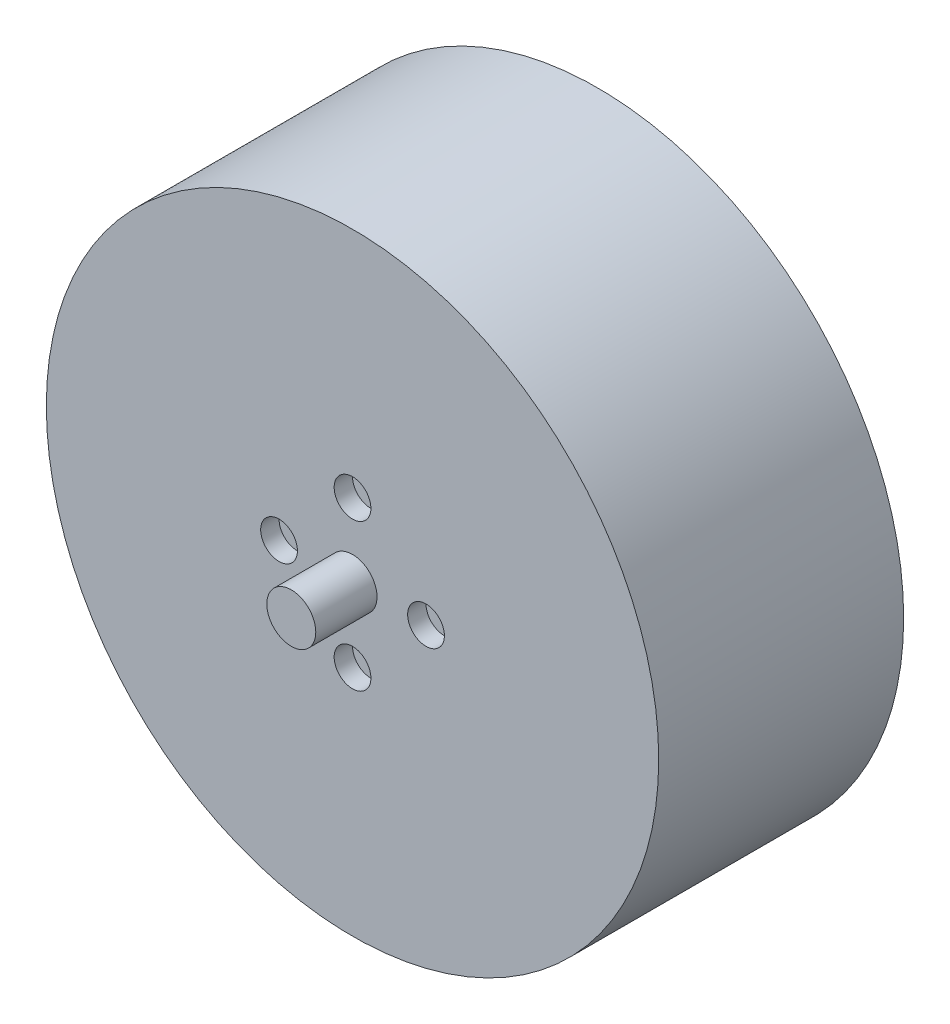
from build123d import *

# Parameters (mm, degrees)
SKETCH1_R           = 12.5
SKETCH1_R_2         = 1.5
BOSS_EXTRUDE1_DEPTH = 4
SKETCH2_R           = 5
BOSS_EXTRUDE2_DEPTH = 3
SKETCH3_R           = 25
BOSS_EXTRUDE3_DEPTH = 20
SKETCH4_R           = 1.5
CUT_EXTRUDE1_DEPTH  = 1.5
SKETCH5_R           = 2
BOSS_EXTRUDE4_DEPTH = 5
SKETCH6_R           = 5.5
CUT_EXTRUDE2_DEPTH  = 1.5
SKETCH7_R           = 1.5
CUT_EXTRUDE3_DEPTH  = 5


with BuildPart() as part:
    # Sketch1 → Boss-Extrude1 (new body)
    with BuildSketch(Plane(origin=(0, 0, 0), x_dir=(0, 1, 0), z_dir=(0, 0, 1))):
        with Locations(Location((0, 0, 0), (0, 0, 270))):
            Circle(SKETCH1_R)
        with Locations(Location((0, 9.5, 0), (0, 0, 270))):
            Circle(SKETCH1_R_2, mode=Mode.SUBTRACT)
        with Locations(Location((-8, 0, 0), (0, 0, 270))):
            Circle(SKETCH1_R_2, mode=Mode.SUBTRACT)
        with Locations(Location((8, 0, 0), (0, 0, 270))):
            Circle(SKETCH1_R_2, mode=Mode.SUBTRACT)
        with Locations(Location((0, -9.5, 0), (0, 0, 270))):
            Circle(SKETCH1_R_2, mode=Mode.SUBTRACT)
    extrude(amount=BOSS_EXTRUDE1_DEPTH)

    # Sketch2 → Boss-Extrude2 (add)
    with BuildSketch(Plane.XY.offset(4)):
        Circle(SKETCH2_R)
    extrude(amount=BOSS_EXTRUDE2_DEPTH)

    # Sketch3 → Boss-Extrude3 (add)
    with BuildSketch(Plane.XY.offset(7)):
        Circle(SKETCH3_R)
    extrude(amount=BOSS_EXTRUDE3_DEPTH)

    # Sketch4 → Cut-Extrude1 (cut, symmetric)
    with BuildSketch(Plane.XY.offset(27)):
        with Locations((0, 6)):
            Circle(SKETCH4_R)
        with Locations((6, 0)):
            Circle(SKETCH4_R)
        with Locations((0, -6)):
            Circle(SKETCH4_R)
        with Locations((-6, 0)):
            Circle(SKETCH4_R)
    extrude(amount=CUT_EXTRUDE1_DEPTH, both=True, mode=Mode.SUBTRACT)

    # Sketch5 → Boss-Extrude4 (add)
    with BuildSketch(Plane.XY.offset(27)):
        Circle(SKETCH5_R)
    extrude(amount=BOSS_EXTRUDE4_DEPTH)

    # Sketch6 → Cut-Extrude2 (cut, symmetric)
    with BuildSketch(Plane(origin=(0, 0, 0), x_dir=(1, 0, 0), z_dir=(0, 0, -1))):
        with Locations(Location((0, 0, 0), (0, 0, 180))):
            Circle(SKETCH6_R)
    extrude(amount=CUT_EXTRUDE2_DEPTH, both=True, mode=Mode.SUBTRACT)

    # Sketch7 → Cut-Extrude3 (cut)
    with BuildSketch(Plane(origin=(0, 0, 1.5), x_dir=(1, 0, 0), z_dir=(0, 0, -1))):
        with Locations(Location((0, 0, 0), (0, 0, 180))):
            Circle(SKETCH7_R)
    extrude(amount=-CUT_EXTRUDE3_DEPTH, mode=Mode.SUBTRACT)


solid = part.part
